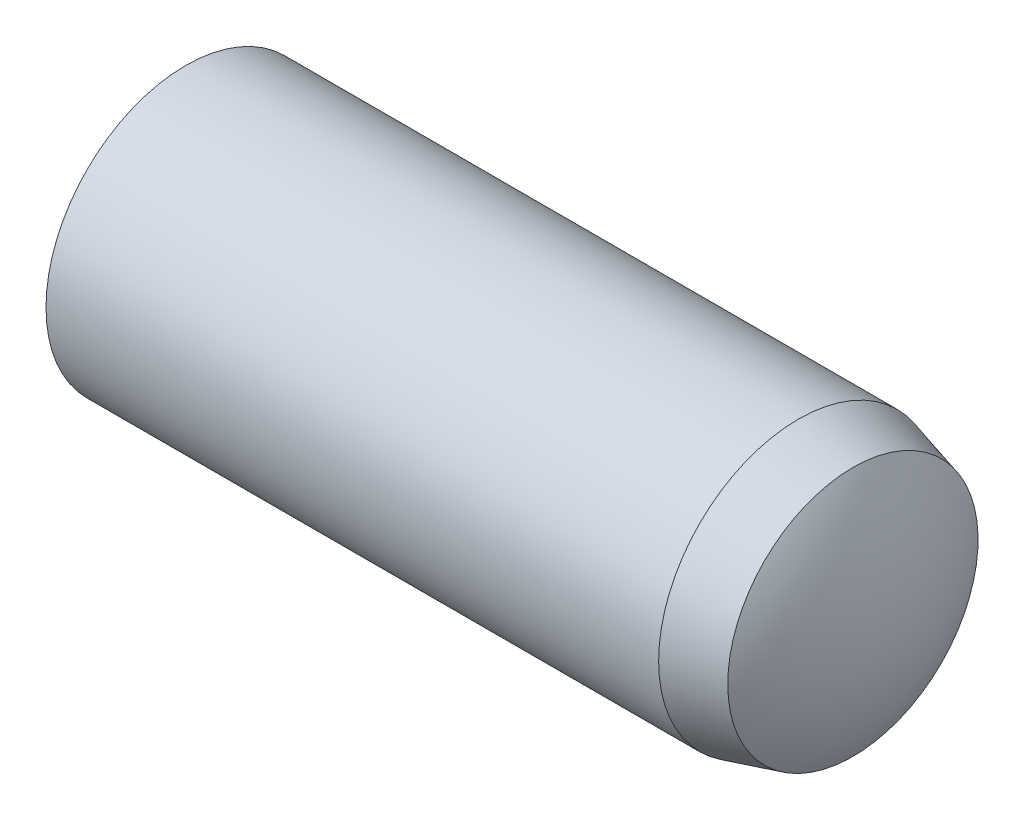
from build123d import *

# Parameters (mm, degrees)
EXTRUDE1_DEPTH      = 4
EXTRUDE1_DEPTH_BACK = 4
SKETCH2_R           = 1.5


with BuildPart() as part:
    # Sketch2 → Extrude1 (new, two sides: drawn at the far end of the back side and taken through both)
    with BuildSketch(Plane(origin=(0, 0, 0), x_dir=(0, 0, -1), z_dir=(1, 0, 0)).offset(-EXTRUDE1_DEPTH_BACK)):
        Circle(SKETCH2_R)
    extrude(amount=EXTRUDE1_DEPTH + EXTRUDE1_DEPTH_BACK)

    # Sketch5 → Cut-Revolve1 (revolve, cut)
    with BuildSketch(Plane.XY, mode=Mode.PRIVATE) as cut_revolve1_sk:
        with BuildLine():
            Line((3.025, 1.5), (3.025, 2))
            Line((3.025, 2), (4.5, 2))
            Line((4.5, 2), (4.5, 0))
            Line((4.5, 0), (4, 0))
            ThreePointArc((4, 0), (3.90052754, 0.699360389), (3.61, 1.343249722))
            Line((3.61, 1.343249722), (3.025, 1.5))
        make_face()
        with BuildLine():
            Line((-3.55, 1.5), (-3.55, 2))
            Line((-3.55, 2), (-4.5, 2))
            Line((-4.5, 2), (-4.5, 0))
            Line((-4.5, 0), (-4, 0))
            ThreePointArc((-4, 0), (-3.885076627, 0.783022988), (-3.55, 1.5))
        make_face()
    revolve(cut_revolve1_sk.sketch.rotate(Axis((-4, 0, 0), (1, 0, 0)), 90), axis=Axis((-4, 0, 0), (1, 0, 0)), mode=Mode.SUBTRACT)


solid = part.part
